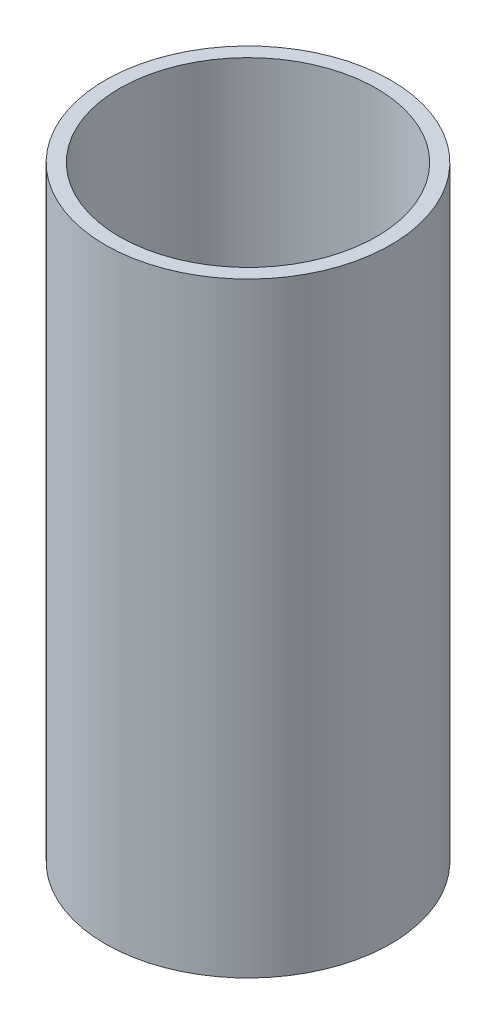
from build123d import *

# Parameters (mm, degrees)
IZIM1_R                     = 50
IZIM1_R_2                   = 45
Y_KSEKLIK_EKSTR_ZYON1_DEPTH = 106


with BuildPart() as part:
    # Çizim1 → Yükseklik-Ekstrüzyon1 (new, symmetric)
    with BuildSketch(Plane(origin=(0, 0, 0), x_dir=(1, 0, 0), z_dir=(0, 1, 0))):
        with Locations(Location((0, 0, 0), (0, 0, 270))):
            Circle(IZIM1_R)
        with Locations(Location((0, 0, 0), (0, 0, 270))):
            Circle(IZIM1_R_2, mode=Mode.SUBTRACT)
    extrude(amount=Y_KSEKLIK_EKSTR_ZYON1_DEPTH, both=True)


solid = part.part
